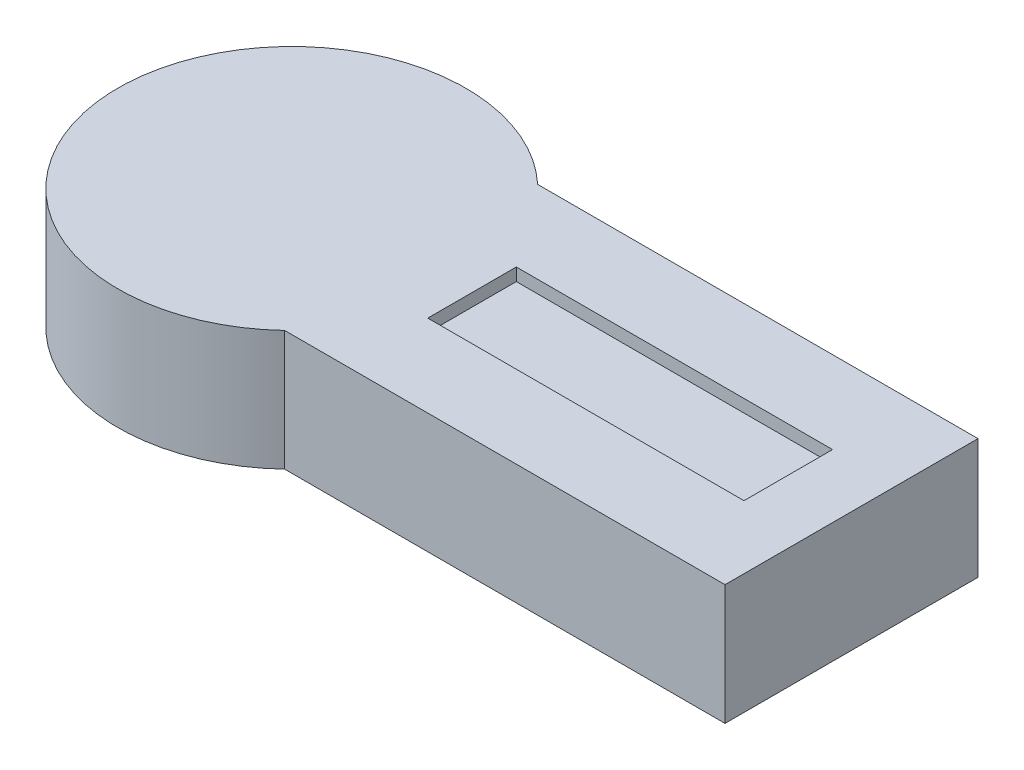
from build123d import *

# Parameters (mm, degrees)
SKETCH1_R                = 13.75
BOSS_EXTRUDE1_DEPTH      = 9.5
SKETCH2_W                = 44.25
SKETCH2_H                = 20
BOSS_EXTRUDE2_DEPTH      = 9.5
BOSS_EXTRUDE3_REACH      = 49.301
BOSS_EXTRUDE3_END_RADIUS = 16.25
SKETCH3_R                = 2
SKETCH4_W                = 25
SKETCH4_H                = 7
CUT_EXTRUDE1_DEPTH       = 1


with BuildPart() as part:
    # Sketch1 → Boss-Extrude1 (new body)
    with BuildSketch(Plane(origin=(0, 0, 0), x_dir=(1, 0, 0), z_dir=(0, 1, 0))):
        with Locations(Location((0, 0, 0), (0, 0, 270))):
            Circle(SKETCH1_R)
    extrude(amount=BOSS_EXTRUDE1_DEPTH)

    # Sketch2 → Boss-Extrude2 (add)
    with BuildSketch(Plane(origin=(0, 0, 0), x_dir=(1, 0, 0), z_dir=(0, 1, 0))):
        with Locations((22.125, 0)):
            Rectangle(SKETCH2_W, SKETCH2_H)
    extrude(amount=BOSS_EXTRUDE2_DEPTH)

    # Boss-Extrude3: up to this cylinder (the profile starts inside it)
    boss_extrude3_end = Plane(origin=(0, 4.5, 0), z_dir=(0, -1, 0)) * Cylinder(BOSS_EXTRUDE3_END_RADIUS, 132.102, mode=Mode.PRIVATE)
    # Sketch3 → Boss-Extrude3 (add, up to the surface)
    with BuildSketch(Plane(origin=(0, 0, 0), x_dir=(0, 0, -1), z_dir=(1, 0, 0)), mode=Mode.PRIVATE) as boss_extrude3_sk1:
        with Locations((0, 4.5)):
            Circle(SKETCH3_R)
    boss_extrude3_tool1 = extrude(boss_extrude3_sk1.sketch, amount=-BOSS_EXTRUDE3_REACH, mode=Mode.PRIVATE) & boss_extrude3_end
    add(boss_extrude3_tool1.solids().sort_by_distance((0, 4.5, 0))[0])

    # Sketch4 → Cut-Extrude1 (cut)
    with BuildSketch(Plane(origin=(0, 9.5, 0), x_dir=(1, 0, 0), z_dir=(0, 1, 0))):
        with Locations((26.75, 0)):
            Rectangle(SKETCH4_W, SKETCH4_H)
    extrude(amount=-CUT_EXTRUDE1_DEPTH, mode=Mode.SUBTRACT)


solid = part.part
